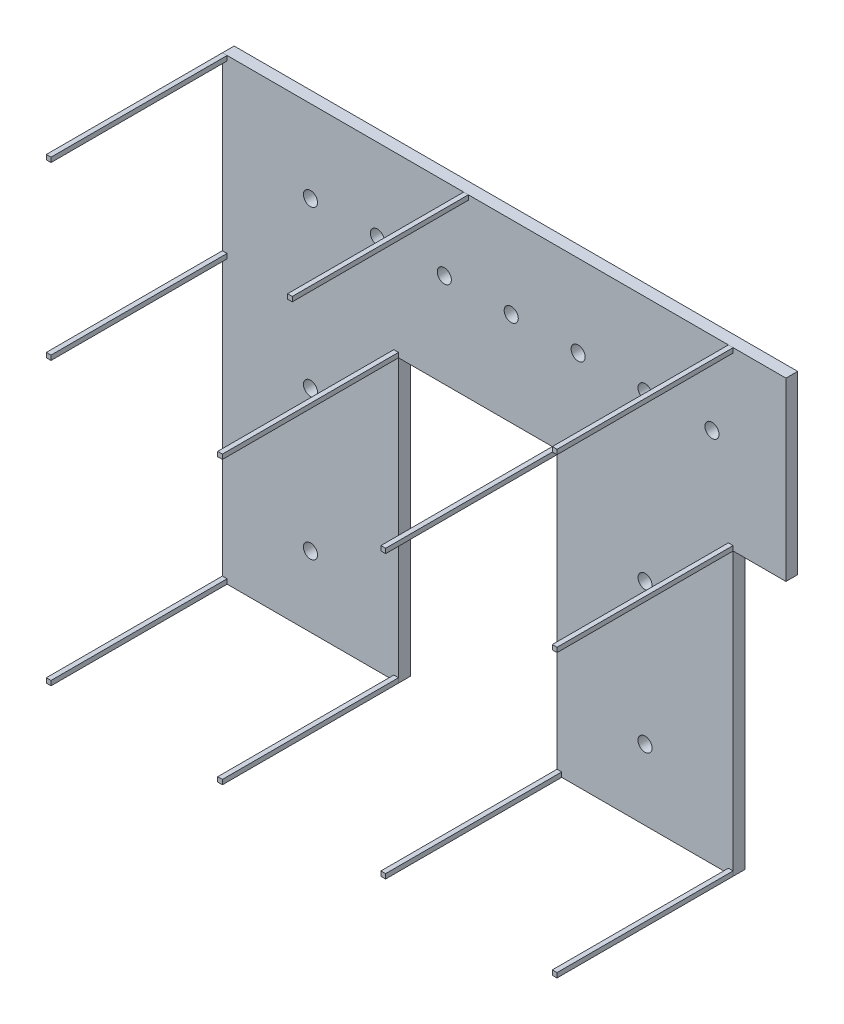
from build123d import *

# Parameters (mm, degrees)
SKETCH1_R              = 60
BOSS_EXTRUDE1_DEPTH    = 100
SKETCH2_W              = 40
SKETCH2_H              = 40
BOSS_EXTRUDE2_DEPTH    = 1500
BOSS_EXTRUDE2_2_DEPTH  = 1500
BOSS_EXTRUDE2_3_DEPTH  = 1500
BOSS_EXTRUDE2_4_DEPTH  = 1500
BOSS_EXTRUDE2_5_DEPTH  = 1500
BOSS_EXTRUDE2_6_DEPTH  = 1500
BOSS_EXTRUDE2_7_DEPTH  = 1500
BOSS_EXTRUDE2_8_DEPTH  = 1500
BOSS_EXTRUDE2_9_DEPTH  = 1500
BOSS_EXTRUDE2_10_DEPTH = 1500
BOSS_EXTRUDE2_11_DEPTH = 1500


with BuildPart() as part:
    # Sketch1 → Boss-Extrude1 (new body)
    with BuildSketch(Plane.XY):
        Polygon((0, 0), (0, 3900), (4800, 3900), (4800, 2400), (4350, 2400), (4350, 0), (2850, 0), (2850, 2400), (1500, 2400), (1500, 0), align=None)
        with Locations(Location((750, 3200, 0), (0, 0, 180))):
            Circle(SKETCH1_R, mode=Mode.SUBTRACT)
        with Locations(Location((1320, 3200, 0), (0, 0, 180))):
            Circle(SKETCH1_R, mode=Mode.SUBTRACT)
        with Locations(Location((1890, 3200, 0), (0, 0, 180))):
            Circle(SKETCH1_R, mode=Mode.SUBTRACT)
        with Locations(Location((2460, 3200, 0), (0, 0, 180))):
            Circle(SKETCH1_R, mode=Mode.SUBTRACT)
        with Locations(Location((3030, 3200, 0), (0, 0, 180))):
            Circle(SKETCH1_R, mode=Mode.SUBTRACT)
        with Locations(Location((3600, 3200, 0), (0, 0, 180))):
            Circle(SKETCH1_R, mode=Mode.SUBTRACT)
        with Locations(Location((4170, 3200, 0), (0, 0, 180))):
            Circle(SKETCH1_R, mode=Mode.SUBTRACT)
        with Locations(Location((750, 1800, 0), (0, 0, 180))):
            Circle(SKETCH1_R, mode=Mode.SUBTRACT)
        with Locations(Location((750, 600, 0), (0, 0, 180))):
            Circle(SKETCH1_R, mode=Mode.SUBTRACT)
        with Locations(Location((3600, 600, 0), (0, 0, 180))):
            Circle(SKETCH1_R, mode=Mode.SUBTRACT)
        with Locations(Location((3600, 1800, 0), (0, 0, 180))):
            Circle(SKETCH1_R, mode=Mode.SUBTRACT)
    extrude(amount=BOSS_EXTRUDE1_DEPTH)


with BuildPart() as body_2:
    # Sketch2 → Boss-Extrude2 (new body)
    with BuildSketch(Plane.XY.offset(100)):
        with Locations((2870, 2420)):
            Rectangle(SKETCH2_W, SKETCH2_H)
    extrude(amount=BOSS_EXTRUDE2_DEPTH)


with BuildPart() as body_3:
    # Sketch2 → Boss-Extrude2 2 (new body)
    with BuildSketch(Plane.XY.offset(100)):
        with Locations((20, 3880)):
            Rectangle(SKETCH2_W, SKETCH2_H)
    extrude(amount=BOSS_EXTRUDE2_2_DEPTH)


with BuildPart() as body_4:
    # Sketch2 → Boss-Extrude2 3 (new body)
    with BuildSketch(Plane.XY.offset(100)):
        with Locations((20, 20)):
            Rectangle(SKETCH2_W, SKETCH2_H)
    extrude(amount=BOSS_EXTRUDE2_3_DEPTH)


with BuildPart() as body_5:
    # Sketch2 → Boss-Extrude2 4 (new body)
    with BuildSketch(Plane.XY.offset(100)):
        with Locations((1480, 20)):
            Rectangle(SKETCH2_W, SKETCH2_H)
    extrude(amount=BOSS_EXTRUDE2_4_DEPTH)


with BuildPart() as body_6:
    # Sketch2 → Boss-Extrude2 5 (new body)
    with BuildSketch(Plane.XY.offset(100)):
        with Locations((1480, 2420)):
            Rectangle(SKETCH2_W, SKETCH2_H)
    extrude(amount=BOSS_EXTRUDE2_5_DEPTH)


with BuildPart() as body_7:
    # Sketch2 → Boss-Extrude2 6 (new body)
    with BuildSketch(Plane.XY.offset(100)):
        with Locations((4330, 20)):
            Rectangle(SKETCH2_W, SKETCH2_H)
    extrude(amount=BOSS_EXTRUDE2_6_DEPTH)


with BuildPart() as body_8:
    # Sketch2 → Boss-Extrude2 7 (new body)
    with BuildSketch(Plane.XY.offset(100)):
        with Locations((2870, 20)):
            Rectangle(SKETCH2_W, SKETCH2_H)
    extrude(amount=BOSS_EXTRUDE2_7_DEPTH)


with BuildPart() as body_9:
    # Sketch2 → Boss-Extrude2 8 (new body)
    with BuildSketch(Plane.XY.offset(100)):
        with Locations((4330, 2420)):
            Rectangle(SKETCH2_W, SKETCH2_H)
    extrude(amount=BOSS_EXTRUDE2_8_DEPTH)


with BuildPart() as body_10:
    # Sketch2 → Boss-Extrude2 9 (new body)
    with BuildSketch(Plane.XY.offset(100)):
        with Locations((4330, 3880)):
            Rectangle(SKETCH2_W, SKETCH2_H)
    extrude(amount=BOSS_EXTRUDE2_9_DEPTH)


with BuildPart() as body_11:
    # Sketch2 → Boss-Extrude2 10 (new body)
    with BuildSketch(Plane.XY.offset(100)):
        with Locations((2075, 3880)):
            Rectangle(SKETCH2_W, SKETCH2_H)
    extrude(amount=BOSS_EXTRUDE2_10_DEPTH)


with BuildPart() as body_12:
    # Sketch2 → Boss-Extrude2 11 (new body)
    with BuildSketch(Plane.XY.offset(100)):
        with Locations((20, 2420)):
            Rectangle(SKETCH2_W, SKETCH2_H)
    extrude(amount=BOSS_EXTRUDE2_11_DEPTH)


solid = Compound([part.part, body_2.part, body_3.part, body_4.part, body_5.part, body_6.part, body_7.part, body_8.part, body_9.part, body_10.part, body_11.part, body_12.part])
